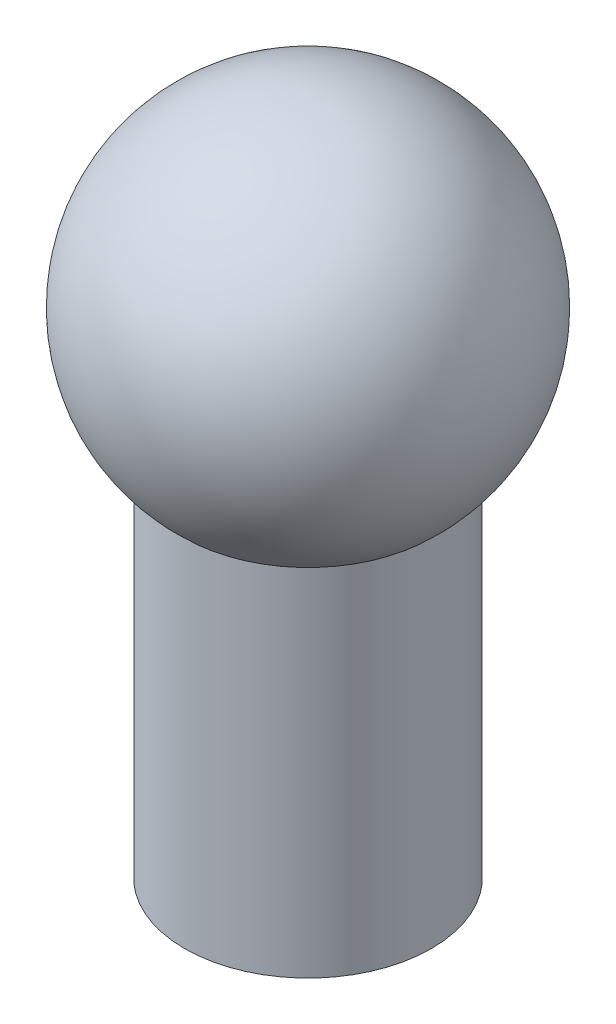
from build123d import *

# Parameters (mm, degrees)
SKETCH_1_R      = 10
EXTRUDE_1_DEPTH = 40


with BuildPart() as part:
    # 草图1 → 凸台-拉伸1 (new body)
    with BuildSketch(Plane(origin=(0, 0, 0), x_dir=(1, 0, 0), z_dir=(0, 1, 0))):
        with Locations(Location((0, 0, 0), (0, 0, 270))):
            Circle(SKETCH_1_R)
    extrude(amount=EXTRUDE_1_DEPTH)

    # 草图2 → 旋转2 (revolve)
    with BuildSketch(Plane(origin=(0, 40, 0), x_dir=(1, 0, 0), z_dir=(0, 1, 0))):
        with BuildLine():
            Line((0, -15), (0, 15))
            ThreePointArc((0, 15), (15, 0), (0, -15))
        make_face()
    revolve(axis=Axis((0, 40, 15), (0, 0, -1)))


solid = part.part
